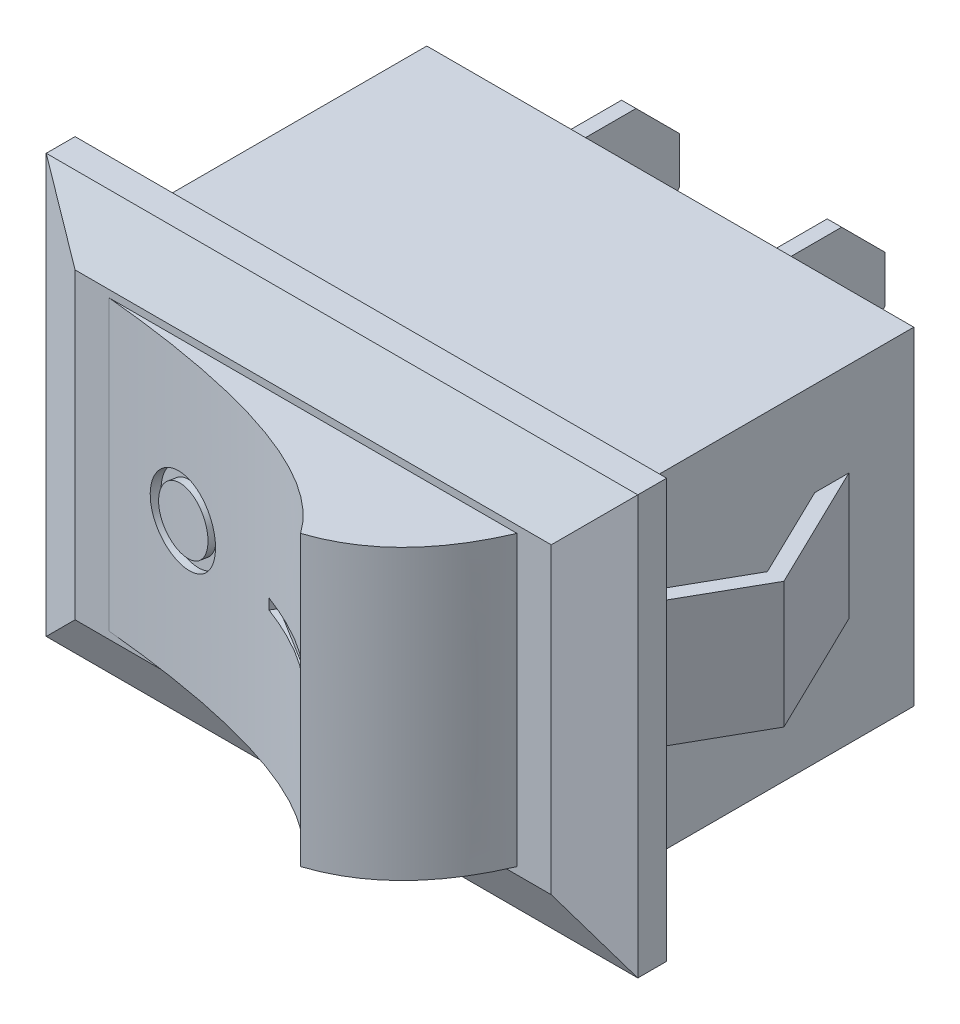
from build123d import *

# Parameters (mm, degrees)
SKETCH1_W           = 17.145
SKETCH1_H           = 11.557
BOSS_EXTRUDE1_DEPTH = 10.541
SKETCH2_W           = 0.508
SKETCH2_H           = 4.699
BOSS_EXTRUDE2_DEPTH = 6.731
CUT_EXTRUDE1_REACH  = 24.017
SKETCH3_R           = 0.381
SKETCH4_W           = 20.828
SKETCH4_H           = 14.732
SKETCH4_W_2         = 14.364137932
SKETCH4_H_2         = 10.16
BOSS_EXTRUDE3_DEPTH = 2.032
CUT_EXTRUDE2_DEPTH  = 28.121934578
CUT_EXTRUDE3_DEPTH  = 28.652554914
BOSS_EXTRUDE4_DEPTH = 10.16
SKETCH8_W           = 3.055360255
SKETCH8_H           = 0.37050197
CUT_EXTRUDE4_DEPTH  = 0.4445
SKETCH9_R           = 1.410409678
SKETCH9_R_2         = 1.066337698
CUT_EXTRUDE5_DEPTH  = 0.4572
BOSS_EXTRUDE5_DEPTH = 4.445


with BuildPart() as part:
    # Sketch1 → Boss-Extrude1 (new body)
    with BuildSketch(Plane.XY):
        with Locations((8.5725, 5.7785)):
            Rectangle(SKETCH1_W, SKETCH1_H)
    extrude(amount=BOSS_EXTRUDE1_DEPTH)

    # Sketch2 → Boss-Extrude2 (add)
    with BuildSketch(Plane(origin=(0, 0, 0), x_dir=(-1, 0, 0), z_dir=(0, 0, -1))):
        with Locations((-1.905, 5.7785)):
            Rectangle(SKETCH2_W, SKETCH2_H)
        with Locations((-9.144, 5.7785)):
            Rectangle(SKETCH2_W, SKETCH2_H)
    extrude(amount=BOSS_EXTRUDE2_DEPTH)

    # Cut-Extrude1: up to this face of the body (flat: up to its plane)
    cut_extrude1_end = Plane(part.part.faces().sort_by_distance((9.398, 5.7785, -3.3655))[0])
    # Sketch3 → Cut-Extrude1 (cut, up to the picked face)
    with BuildSketch(Plane.ZY.offset(-1.651), mode=Mode.PRIVATE) as cut_extrude1_sk1:
        with Locations((-0.508, 5.7785)):
            Circle(SKETCH3_R)
    cut_extrude1_tool1 = split(extrude(cut_extrude1_sk1.sketch, amount=-CUT_EXTRUDE1_REACH, mode=Mode.PRIVATE), bisect_by=cut_extrude1_end, keep=Keep.BOTH, mode=Mode.PRIVATE)
    # Sketch3 → Cut-Extrude1 (cut, up to the picked face)
    with BuildSketch(Plane.ZY.offset(-1.651), mode=Mode.PRIVATE) as cut_extrude1_sk2:
        Polygon((-6.731, 6.604), (-5.207, 8.128), (-6.731, 8.128), align=None)
    cut_extrude1_tool2 = split(extrude(cut_extrude1_sk2.sketch, amount=-CUT_EXTRUDE1_REACH, mode=Mode.PRIVATE), bisect_by=cut_extrude1_end, keep=Keep.BOTH, mode=Mode.PRIVATE)
    # Sketch3 → Cut-Extrude1 (cut, up to the picked face)
    with BuildSketch(Plane.ZY.offset(-1.651), mode=Mode.PRIVATE) as cut_extrude1_sk3:
        Polygon((-6.731, 4.953), (-5.207, 3.429), (-6.731, 3.429), align=None)
    cut_extrude1_tool3 = split(extrude(cut_extrude1_sk3.sketch, amount=-CUT_EXTRUDE1_REACH, mode=Mode.PRIVATE), bisect_by=cut_extrude1_end, keep=Keep.BOTH, mode=Mode.PRIVATE)
    # Sketch3 → Cut-Extrude1 (cut, up to the picked face)
    with BuildSketch(Plane.ZY.offset(-1.651), mode=Mode.PRIVATE) as cut_extrude1_sk4:
        with BuildLine():
            ThreePointArc((-4.699, 5.3975), (-3.556, 5.7785), (-4.699, 6.1595))
            ThreePointArc((-4.699, 6.1595), (-5.08, 5.7785), (-4.699, 5.3975))
        make_face()
    cut_extrude1_tool4 = split(extrude(cut_extrude1_sk4.sketch, amount=-CUT_EXTRUDE1_REACH, mode=Mode.PRIVATE), bisect_by=cut_extrude1_end, keep=Keep.BOTH, mode=Mode.PRIVATE)
    add(cut_extrude1_tool1.solids().sort_by(Axis((1.651, 5.7785, -0.508), (1, 0, 0)))[0], mode=Mode.SUBTRACT)
    add(cut_extrude1_tool2.solids().sort_by(Axis((1.651, 7.62, -6.223), (1, 0, 0)))[0], mode=Mode.SUBTRACT)
    add(cut_extrude1_tool3.solids().sort_by(Axis((1.651, 3.937, -6.223), (1, 0, 0)))[0], mode=Mode.SUBTRACT)
    add(cut_extrude1_tool4.solids().sort_by(Axis((1.651, 5.7785, -4.272067), (1, 0, 0)))[0], mode=Mode.SUBTRACT)

    # Sketch4 → Boss-Extrude3 (add)
    with BuildSketch(Plane.XY.offset(10.541)):
        with Locations((8.5725, 5.7785)):
            Rectangle(SKETCH4_W, SKETCH4_H)
        with Locations((8.5725, 5.7785)):
            Rectangle(SKETCH4_W_2, SKETCH4_H_2, mode=Mode.SUBTRACT)
    extrude(amount=BOSS_EXTRUDE3_DEPTH)

    # Sketch5 → Cut-Extrude2 (cut, through all)
    with BuildSketch(Plane.XZ.offset(1.5875)):
        Polygon((-1.8415, 11.557), (0.1905, 12.573), (-1.8415, 12.573), align=None)
        Polygon((16.9545, 12.573), (18.9865, 11.557), (18.9865, 12.573), align=None)
    extrude(amount=-CUT_EXTRUDE2_DEPTH, mode=Mode.SUBTRACT)

    # Sketch6 → Cut-Extrude3 (cut, through all)
    with BuildSketch(Plane(origin=(18.9865, 0, 0), x_dir=(0, 0, -1), z_dir=(1, 0, 0))):
        Polygon((-11.557, 13.1445), (-12.573, 11.1125), (-12.573, 13.1445), align=None)
        Polygon((-11.557, -1.5875), (-12.573, -1.5875), (-12.573, 0.4445), align=None)
    extrude(amount=-CUT_EXTRUDE3_DEPTH, mode=Mode.SUBTRACT)

    # Sketch7 → Boss-Extrude4 (add)
    with BuildSketch(Plane.XZ.offset(-10.8585)):
        with BuildLine():
            Line((15.749219614, 10.541), (15.749219614, 12.573))
            add(Edge.make_bspline(
                [(15.749219614, 12.573), (14.476637744, 15.554000954), (11.939219614, 16.383)],
                knots=[0, 0, 0, 1, 1, 1], degree=2))
            add(Edge.make_bspline(
                [(11.939219614, 16.383), (9.824691935, 13.388087839), (1.390431034, 12.573)],
                knots=[0, 0, 0, 1, 1, 1], degree=2))
            Line((1.390431034, 12.573), (1.390431034, 10.541))
            Line((1.390431034, 10.541), (15.749219614, 10.541))
        make_face()
    extrude(amount=BOSS_EXTRUDE4_DEPTH)

    # Sketch8 → Cut-Extrude4 (cut)
    with BuildSketch(Plane(origin=(-4.022149692, 0, 6.488075329), x_dir=(-0.8499295023207375, 0, -0.5268964234883585), z_dir=(0.5268964234883585, 0, -0.8499295023207375))):
        with Locations((-16.095593607, 5.7785)):
            Rectangle(SKETCH8_W, SKETCH8_H)
    extrude(amount=CUT_EXTRUDE4_DEPTH, mode=Mode.SUBTRACT)

    # Sketch9 → Cut-Extrude5 (cut)
    with BuildSketch(Plane(origin=(-2.340608329, 0, 11.835119688), x_dir=(0.9809994846940211, 0, 0.1940103374309346), z_dir=(-0.1940103374309346, 0, 0.9809994846940211))):
        with Locations((6.849694399, 5.7785)):
            Circle(SKETCH9_R)
        with Locations((6.849694399, 5.7785)):
            Circle(SKETCH9_R_2, mode=Mode.SUBTRACT)
    extrude(amount=-CUT_EXTRUDE5_DEPTH, mode=Mode.SUBTRACT)

    # Sketch10 → Boss-Extrude5 (add)
    with BuildSketch(Plane(origin=(0, 8.255, 0), x_dir=(1, 0, 0), z_dir=(0, 1, 0))):
        Polygon((0, -10.541), (-2.159, -6.731), (0, -2.286), (0, -3.488132969), (-1.575106844, -6.731), (0, -9.510600313), align=None)
    boss_extrude5 = extrude(amount=-BOSS_EXTRUDE5_DEPTH)

    # Mirror1: Boss-Extrude5 across plane
    add(boss_extrude5.mirror(Plane(origin=(8.5725, 0, 0), x_dir=(0, 0, 1), z_dir=(1, 0, 0))))


solid = part.part
